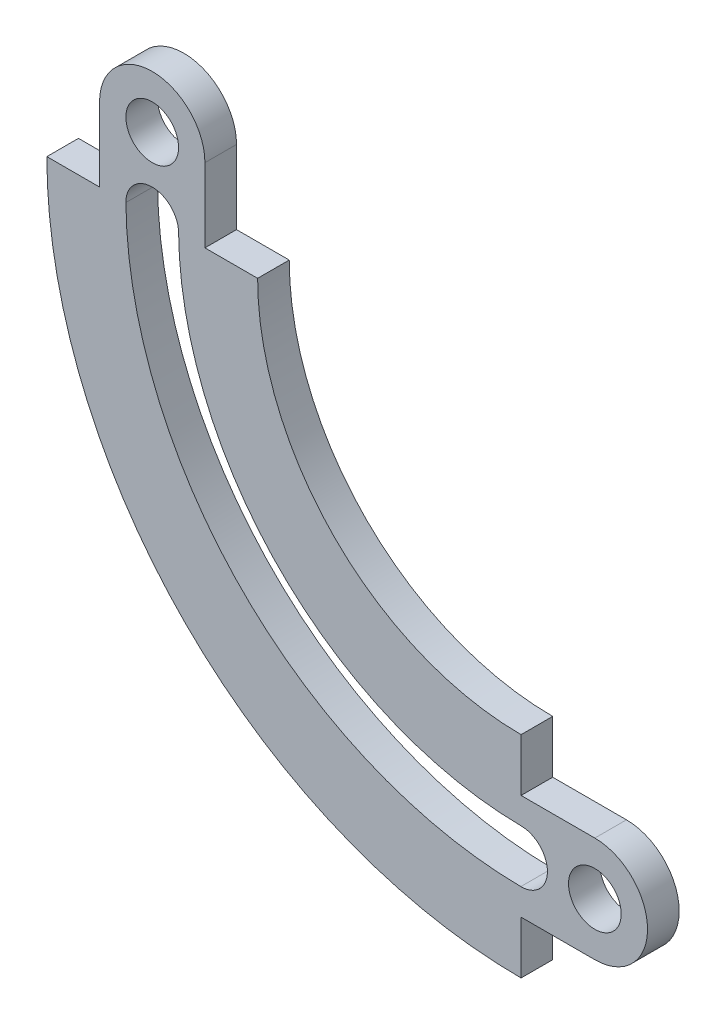
from build123d import *

# Parameters (mm, degrees)
SALIENTE_EXTRUIR1_DEPTH = 6
CROQUIS3_R              = 5
CORTAR_EXTRUIR1_DEPTH   = 6
CORTAR_EXTRUIR3_DEPTH   = 6


with BuildPart() as part:
    # cuadrado → Saliente-Extruir1 (new body)
    with BuildSketch(Plane.XY):
        with BuildLine():
            Line((-50, 90), (-60, 90))
            Line((-60, 90), (-60, 104))
            ThreePointArc((-60, 104), (-70, 114), (-80, 104))
            Line((-80, 104), (-80, 90))
            Line((-80, 90), (-90, 90))
            ThreePointArc((-90, 90), (-63.639610307, 26.360389693), (0, 0))
            Line((0, 0), (0, 10))
            Line((0, 10), (14, 10))
            ThreePointArc((14, 10), (24, 20), (14, 30))
            Line((14, 30), (0, 30))
            Line((0, 30), (0, 40))
            ThreePointArc((0, 40), (-35.355339059, 54.644660941), (-50, 90))
        make_face()
    extrude(amount=SALIENTE_EXTRUIR1_DEPTH)

    # Croquis3 → Cortar-Extruir1 (cut)
    with BuildSketch(Plane.XY):
        with Locations((-70, 104)):
            Circle(CROQUIS3_R)
        with Locations((14, 20)):
            Circle(CROQUIS3_R)
    extrude(amount=CORTAR_EXTRUIR1_DEPTH, mode=Mode.SUBTRACT)

    # Croquis4 → Cortar-Extruir3 (cut)
    with BuildSketch(Plane.XY):
        with BuildLine():
            ThreePointArc((-74.999538142, 89.951945487), (-52.836185081, 37.163814919), (-0.048054513, 15.000461858))
            ThreePointArc((-0.048054513, 15.000461858), (4.999769071, 19.952176416), (0.048054513, 25))
            ThreePointArc((0.048054513, 25), (-45.765117269, 44.234882731), (-65, 90.048054513))
            ThreePointArc((-65, 90.048054513), (-70.047823584, 94.999769071), (-74.999538142, 89.951945487))
        make_face()
    extrude(amount=CORTAR_EXTRUIR3_DEPTH, mode=Mode.SUBTRACT)


solid = part.part
